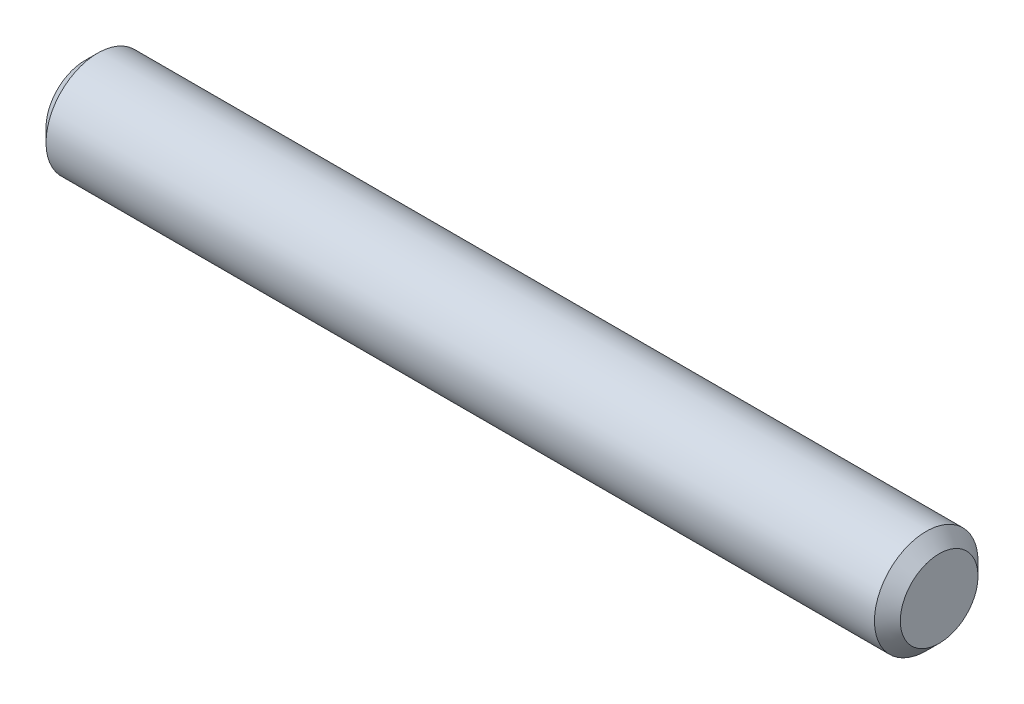
from build123d import *


with BuildPart() as part:
    # Esquisse1 → Base-Révolution (revolve)
    with BuildSketch(Plane.XY, mode=Mode.PRIVATE) as base_r_volution_sk:
        Polygon((0, 0), (0, 3), (1, 4), (65, 4), (66, 3), (66, 0), align=None)
    revolve(base_r_volution_sk.sketch.rotate(Axis((-3, 0, 0), (1, 0, 0)), 90), axis=Axis((-3, 0, 0), (1, 0, 0)))


solid = part.part
